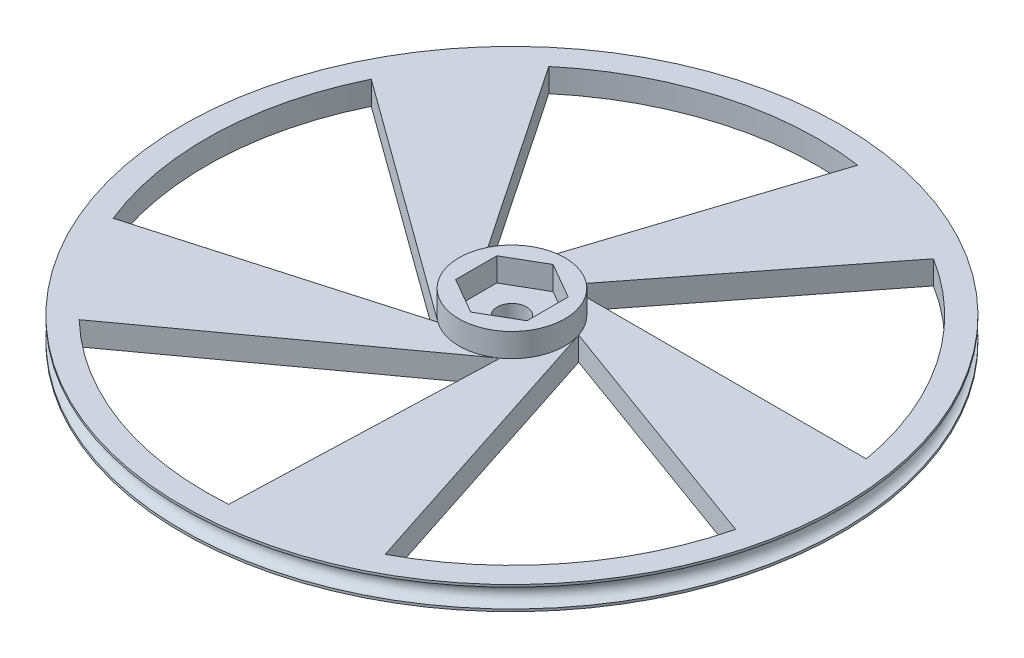
from build123d import *

# Parameters (mm, degrees)
CUT_EXTRUDE_1_DEPTH = 80.296910406
CUT_EXTRUDE_2_DEPTH = 4


with BuildPart() as part:
    # 草图1 → 旋转1 (revolve)
    with BuildSketch(Plane.XY):
        with BuildLine():
            Line((9, 8), (2.5, 8))
            Line((2.5, 8), (2.5, 0))
            Line((2.5, 0), (56, 0))
            Line((56, 0), (56, 0.4))
            ThreePointArc((56, 0.4), (54.4, 2), (56, 3.6))
            Line((56, 3.6), (56, 4))
            Line((56, 4), (9, 4))
            Line((9, 4), (9, 8))
        make_face()
    revolve(axis=Axis((0, 4, 0), (0, 1, 0)))

    # 草图2 → 切除-拉伸1 (cut, through all)
    with BuildSketch(Plane(origin=(0, 4, 0), x_dir=(1, 0, 0), z_dir=(0, 1, 0))):
        with BuildLine():
            Line((27.465795744, 44.154615434), (0, 9))
            Line((0, 9), (51.215232109, 9))
            ThreePointArc((51.215232109, 9), (43.0887199, 29.109486725), (27.465795744, 44.154615434))
        make_face()
        with BuildLine():
            Line((-8.559508647, 2.781152949), (7.266868446, 51.48973318))
            ThreePointArc((7.266868446, 51.48973318), (-14.369620321, 49.975133935), (-33.506137084, 39.766050567))
            Line((-33.506137084, 39.766050567), (-8.559508647, 2.781152949))
        make_face()
        with BuildLine():
            ThreePointArc((24.385885739, -45.927427282), (40.999913751, -31.984481744), (50.480932382, -12.476997468))
            Line((50.480932382, -12.476997468), (8.559508647, 2.781152949))
            Line((8.559508647, 2.781152949), (24.385885739, -45.927427282))
        make_face()
        with BuildLine():
            Line((-5.290067271, -7.281152949), (-46.724060418, 22.822405177))
            ThreePointArc((-46.724060418, 22.822405177), (-51.969633664, 1.776844639), (-48.173727294, -19.577844585))
            Line((-48.173727294, -19.577844585), (-5.290067271, -7.281152949))
        make_face()
        with BuildLine():
            ThreePointArc((-36.143925877, -37.384711076), (-17.749379666, -48.876983555), (3.733136252, -51.865823947))
            Line((3.733136252, -51.865823947), (5.290067271, -7.281152949))
            Line((5.290067271, -7.281152949), (-36.143925877, -37.384711076))
        make_face()
    extrude(amount=-CUT_EXTRUDE_1_DEPTH, mode=Mode.SUBTRACT)

    # 草图3 → 切除-拉伸2 (cut)
    with BuildSketch(Plane(origin=(0, 8, 0), x_dir=(1, 0, 0), z_dir=(0, 1, 0))):
        Polygon((0, 7), (-6.062177826, 3.5), (-6.062177826, -3.5), (0, -7), (6.062177826, -3.5), (6.062177826, 3.5), align=None)
    extrude(amount=-CUT_EXTRUDE_2_DEPTH, mode=Mode.SUBTRACT)


solid = part.part
